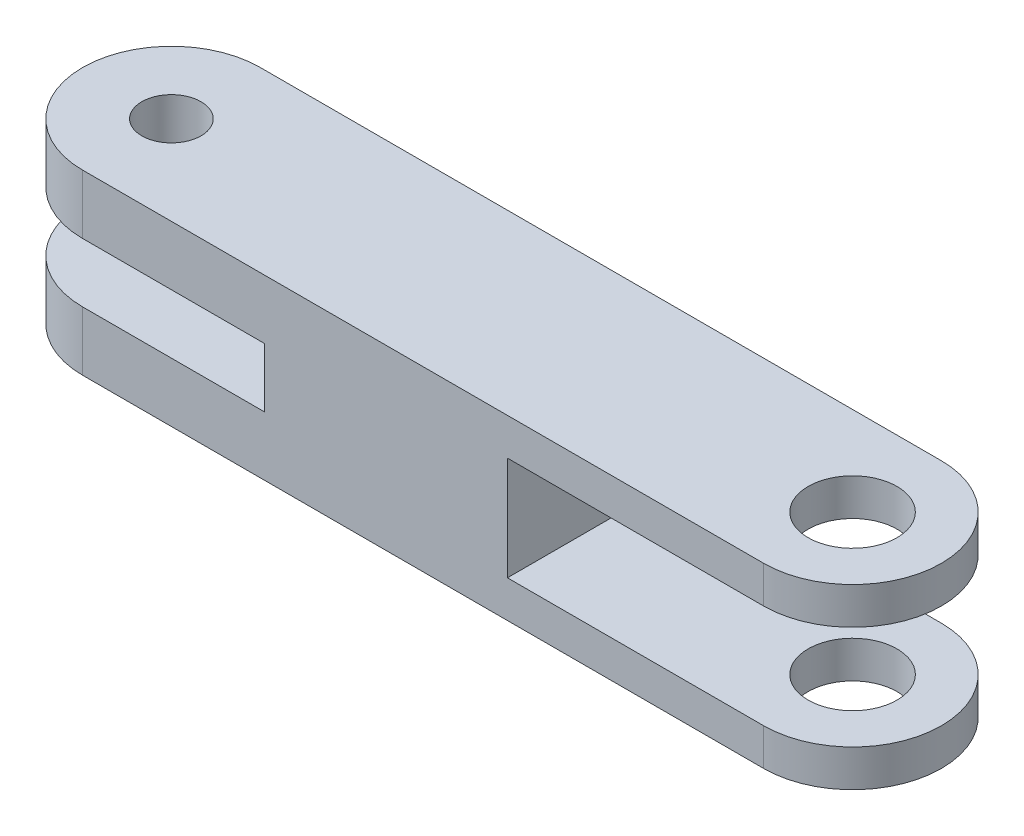
from build123d import *

# Parameters (mm, degrees)
SKETCH_1_R          = 1.5
SKETCH_1_R_2        = 1
EXTRUDE_1_DEPTH     = 3
SKETCH_6_W          = 31.511370345
SKETCH_6_H          = 11.605197544
CUT_EXTRUDE_2_DEPTH = 1.75
SKETCH_7_W          = 12.660216836
SKETCH_7_H          = 9.649927943
CUT_EXTRUDE_3_DEPTH = 1


with BuildPart() as part:
    # 草图1 → 凸台-拉伸1 (new, symmetric)
    with BuildSketch(Plane(origin=(0, 0, 0), x_dir=(1, 0, 0), z_dir=(0, 1, 0))):
        with BuildLine():
            Line((0, 3), (23, 3))
            ThreePointArc((23, 3), (26, 0), (23, -3))
            Line((23, -3), (0, -3))
            ThreePointArc((0, -3), (-3, 0), (0, 3))
        make_face()
        with Locations(Location((23, 0, 0), (0, 0, 270))):
            Circle(SKETCH_1_R, mode=Mode.SUBTRACT)
        with Locations(Location((0, 0, 0), (0, 0, 270))):
            Circle(SKETCH_1_R_2, mode=Mode.SUBTRACT)
    extrude(amount=EXTRUDE_1_DEPTH, both=True)

    # 草图6 → 切除-拉伸2 (cut, symmetric)
    with BuildSketch(Plane(origin=(0, 0, 0), x_dir=(1, 0, 0), z_dir=(0, 1, 0))):
        with Locations((30.101826092, 2.040608699)):
            Rectangle(SKETCH_6_W, SKETCH_6_H)
    extrude(amount=CUT_EXTRUDE_2_DEPTH, both=True, mode=Mode.SUBTRACT)

    # 草图7 → 切除-拉伸3 (cut, symmetric)
    with BuildSketch(Plane(origin=(0, 0, 0), x_dir=(1, 0, 0), z_dir=(0, 1, 0))):
        with Locations((-0.191074288, 0.210879474)):
            Rectangle(SKETCH_7_W, SKETCH_7_H)
    extrude(amount=CUT_EXTRUDE_3_DEPTH, both=True, mode=Mode.SUBTRACT)


solid = part.part
